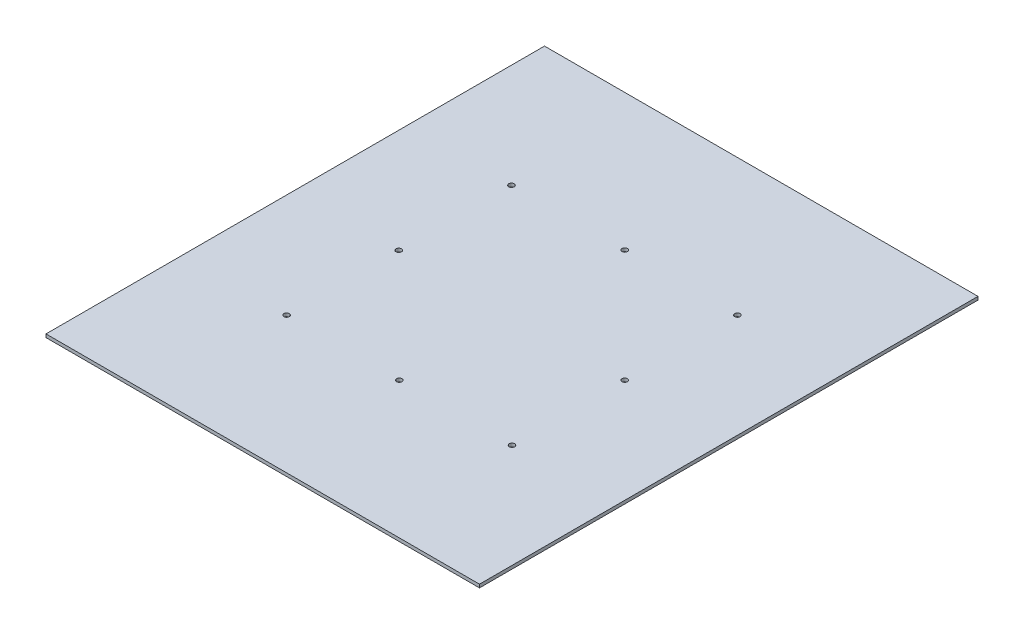
from build123d import *

# Parameters (mm, degrees)
SKETCH1_W           = 400
SKETCH1_H           = 460
SKETCH1_R           = 2.5
BOSS_EXTRUDE1_DEPTH = 3


with BuildPart() as part:
    # Sketch1 → Boss-Extrude1 (new body)
    with BuildSketch(Plane(origin=(0, 0, 0), x_dir=(1, 0, 0), z_dir=(0, 1, 0))):
        with Locations((200, 230)):
            Rectangle(SKETCH1_W, SKETCH1_H)
        with Locations(Location((96, 126, 0), (0, 0, 270))):
            Circle(SKETCH1_R, mode=Mode.SUBTRACT)
        with Locations(Location((96, 333.5, 0), (0, 0, 270))):
            Circle(SKETCH1_R, mode=Mode.SUBTRACT)
        with Locations(Location((304, 334, 0), (0, 0, 270))):
            Circle(SKETCH1_R, mode=Mode.SUBTRACT)
        with Locations(Location((304, 126, 0), (0, 0, 270))):
            Circle(SKETCH1_R, mode=Mode.SUBTRACT)
        with Locations(Location((200, 126, 0), (0, 0, 270))):
            Circle(SKETCH1_R, mode=Mode.SUBTRACT)
        with Locations(Location((200, 334, 0), (0, 0, 270))):
            Circle(SKETCH1_R, mode=Mode.SUBTRACT)
        with Locations(Location((303.999399038, 230.000000002, 0), (0, 0, 270))):
            Circle(SKETCH1_R, mode=Mode.SUBTRACT)
        with Locations(Location((96, 229.5, 0), (0, 0, 270))):
            Circle(SKETCH1_R, mode=Mode.SUBTRACT)
    extrude(amount=BOSS_EXTRUDE1_DEPTH)


solid = part.part
